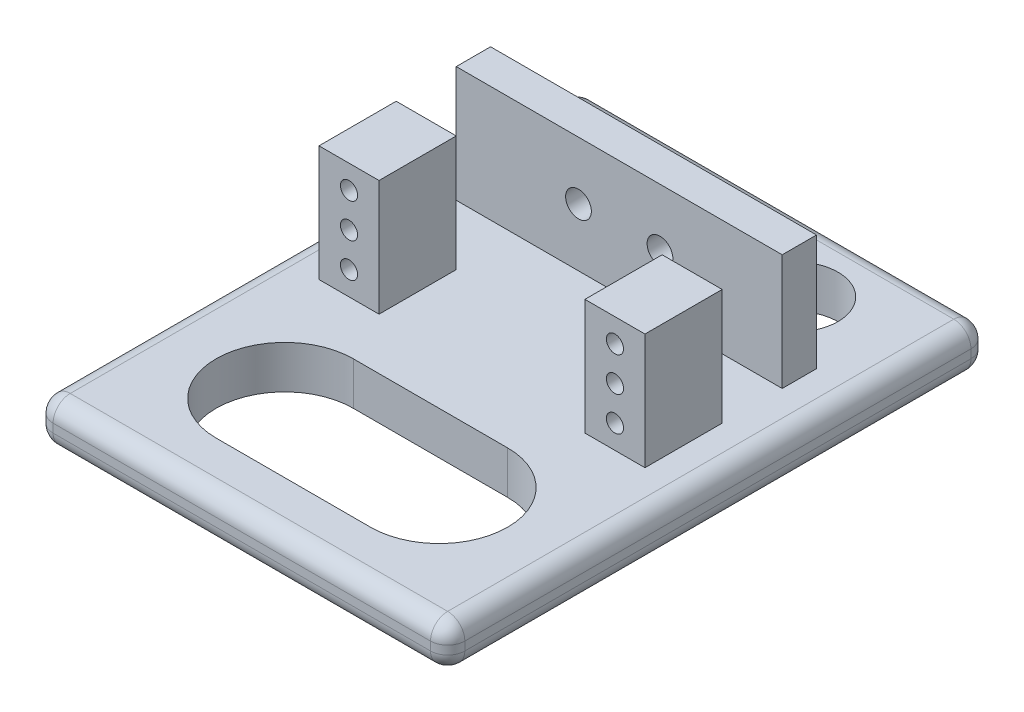
from build123d import *

# Parameters (mm, degrees)
CROQUIS1_W              = 48
CROQUIS1_H              = 63
CROQUIS1_R              = 5
SALIENTE_EXTRUIR1_DEPTH = 5
CROQUIS2_W              = 7
CROQUIS2_H              = 9
CROQUIS2_W_2            = 38
CROQUIS2_H_2            = 4
SALIENTE_EXTRUIR2_DEPTH = 13.5
CORTAR_EXTRUIR1_REACH   = 53.906
CROQUIS3_R              = 1.5
CORTAR_EXTRUIR2_REACH   = 46.534
CROQUIS4_R              = 1
REDONDEO1_R             = 2


with BuildPart() as part:
    # Croquis1 → Saliente-Extruir1 (new body)
    with BuildSketch(Plane(origin=(0, 0, 0), x_dir=(1, 0, 0), z_dir=(0, 1, 0))):
        Rectangle(CROQUIS1_W, CROQUIS1_H)
        with Locations(Location((-10.5, 22.5, 0), (0, 0, 270))):
            Circle(CROQUIS1_R, mode=Mode.SUBTRACT)
        with Locations(Location((10.5, 22.5, 0), (0, 0, 270))):
            Circle(CROQUIS1_R, mode=Mode.SUBTRACT)
        with BuildLine():
            Line((-9, -9.5), (9, -9.5))
            ThreePointArc((9, -9.5), (17, -17.5), (9, -25.5))
            Line((9, -25.5), (-9, -25.5))
            ThreePointArc((-9, -25.5), (-17, -17.5), (-9, -9.5))
        make_face(mode=Mode.SUBTRACT)
    extrude(amount=-SALIENTE_EXTRUIR1_DEPTH)

    # Croquis2 → Saliente-Extruir2 (add)
    with BuildSketch(Plane(origin=(0, 0, 0), x_dir=(1, 0, 0), z_dir=(0, 1, 0))):
        with Locations((15.5, 1)):
            Rectangle(CROQUIS2_W, CROQUIS2_H)
        with Locations((-15.5, 1)):
            Rectangle(CROQUIS2_W, CROQUIS2_H)
        with Locations((0, 14.5)):
            Rectangle(CROQUIS2_W_2, CROQUIS2_H_2)
    extrude(amount=SALIENTE_EXTRUIR2_DEPTH)

    # Croquis3 → Cortar-Extruir1 (cut, up to next)
    with BuildSketch(Plane.XY.offset(-12.5), mode=Mode.PRIVATE) as cortar_extruir1_sk1:
        with Locations((4.75, 6.75)):
            Circle(CROQUIS3_R)
    cortar_extruir1_tool1 = extrude(cortar_extruir1_sk1.sketch, amount=-CORTAR_EXTRUIR1_REACH, mode=Mode.PRIVATE) & part.part
    # Croquis3 → Cortar-Extruir1 (cut, up to next)
    with BuildSketch(Plane.XY.offset(-12.5), mode=Mode.PRIVATE) as cortar_extruir1_sk2:
        with Locations((-4.75, 6.75)):
            Circle(CROQUIS3_R)
    cortar_extruir1_tool2 = extrude(cortar_extruir1_sk2.sketch, amount=-CORTAR_EXTRUIR1_REACH, mode=Mode.PRIVATE) & part.part
    add(cortar_extruir1_tool1.solids().sort_by_distance((4.75, 6.75, -12.5))[0], mode=Mode.SUBTRACT)
    add(cortar_extruir1_tool2.solids().sort_by_distance((-4.75, 6.75, -12.5))[0], mode=Mode.SUBTRACT)

    # Croquis4 → Cortar-Extruir2 (cut, up to next)
    with BuildSketch(Plane.XY.offset(3.5), mode=Mode.PRIVATE) as cortar_extruir2_sk1:
        with Locations((15.5, 6.75)):
            Circle(CROQUIS4_R)
    cortar_extruir2_tool1 = extrude(cortar_extruir2_sk1.sketch, amount=-CORTAR_EXTRUIR2_REACH, mode=Mode.PRIVATE) & part.part
    # Croquis4 → Cortar-Extruir2 (cut, up to next)
    with BuildSketch(Plane.XY.offset(3.5), mode=Mode.PRIVATE) as cortar_extruir2_sk2:
        with Locations((15.5, 2.75)):
            Circle(CROQUIS4_R)
    cortar_extruir2_tool2 = extrude(cortar_extruir2_sk2.sketch, amount=-CORTAR_EXTRUIR2_REACH, mode=Mode.PRIVATE) & part.part
    # Croquis4 → Cortar-Extruir2 (cut, up to next)
    with BuildSketch(Plane.XY.offset(3.5), mode=Mode.PRIVATE) as cortar_extruir2_sk3:
        with Locations((15.5, 10.75)):
            Circle(CROQUIS4_R)
    cortar_extruir2_tool3 = extrude(cortar_extruir2_sk3.sketch, amount=-CORTAR_EXTRUIR2_REACH, mode=Mode.PRIVATE) & part.part
    # Croquis4 → Cortar-Extruir2 (cut, up to next)
    with BuildSketch(Plane.XY.offset(3.5), mode=Mode.PRIVATE) as cortar_extruir2_sk4:
        with Locations((-15.5, 2.75)):
            Circle(CROQUIS4_R)
    cortar_extruir2_tool4 = extrude(cortar_extruir2_sk4.sketch, amount=-CORTAR_EXTRUIR2_REACH, mode=Mode.PRIVATE) & part.part
    # Croquis4 → Cortar-Extruir2 (cut, up to next)
    with BuildSketch(Plane.XY.offset(3.5), mode=Mode.PRIVATE) as cortar_extruir2_sk5:
        with Locations((-15.5, 6.75)):
            Circle(CROQUIS4_R)
    cortar_extruir2_tool5 = extrude(cortar_extruir2_sk5.sketch, amount=-CORTAR_EXTRUIR2_REACH, mode=Mode.PRIVATE) & part.part
    # Croquis4 → Cortar-Extruir2 (cut, up to next)
    with BuildSketch(Plane.XY.offset(3.5), mode=Mode.PRIVATE) as cortar_extruir2_sk6:
        with Locations((-15.5, 10.75)):
            Circle(CROQUIS4_R)
    cortar_extruir2_tool6 = extrude(cortar_extruir2_sk6.sketch, amount=-CORTAR_EXTRUIR2_REACH, mode=Mode.PRIVATE) & part.part
    add(cortar_extruir2_tool1.solids().sort_by_distance((15.5, 6.75, 3.5))[0], mode=Mode.SUBTRACT)
    add(cortar_extruir2_tool2.solids().sort_by_distance((15.5, 2.75, 3.5))[0], mode=Mode.SUBTRACT)
    add(cortar_extruir2_tool3.solids().sort_by_distance((15.5, 10.75, 3.5))[0], mode=Mode.SUBTRACT)
    add(cortar_extruir2_tool4.solids().sort_by_distance((-15.5, 2.75, 3.5))[0], mode=Mode.SUBTRACT)
    add(cortar_extruir2_tool5.solids().sort_by_distance((-15.5, 6.75, 3.5))[0], mode=Mode.SUBTRACT)
    add(cortar_extruir2_tool6.solids().sort_by_distance((-15.5, 10.75, 3.5))[0], mode=Mode.SUBTRACT)

    # Redondeo1
    redondeo1_edges = [part.edges().sort_by_distance(p)[0] for p in [
        (-24, -5, 0),
        (0, -5, 31.5),
        (24, -5, 0),
        (0, 0, 31.5),
        (-24, 0, 0),
        (0, 0, -31.5),
        (24, 0, 0),
        (24, -2.5, 31.5),
        (-24, -2.5, 31.5),
        (-24, -2.5, -31.5),
        (24, -2.5, -31.5),
        (0, -5, -31.5),
    ]]
    fillet(redondeo1_edges, radius=REDONDEO1_R)


solid = part.part
